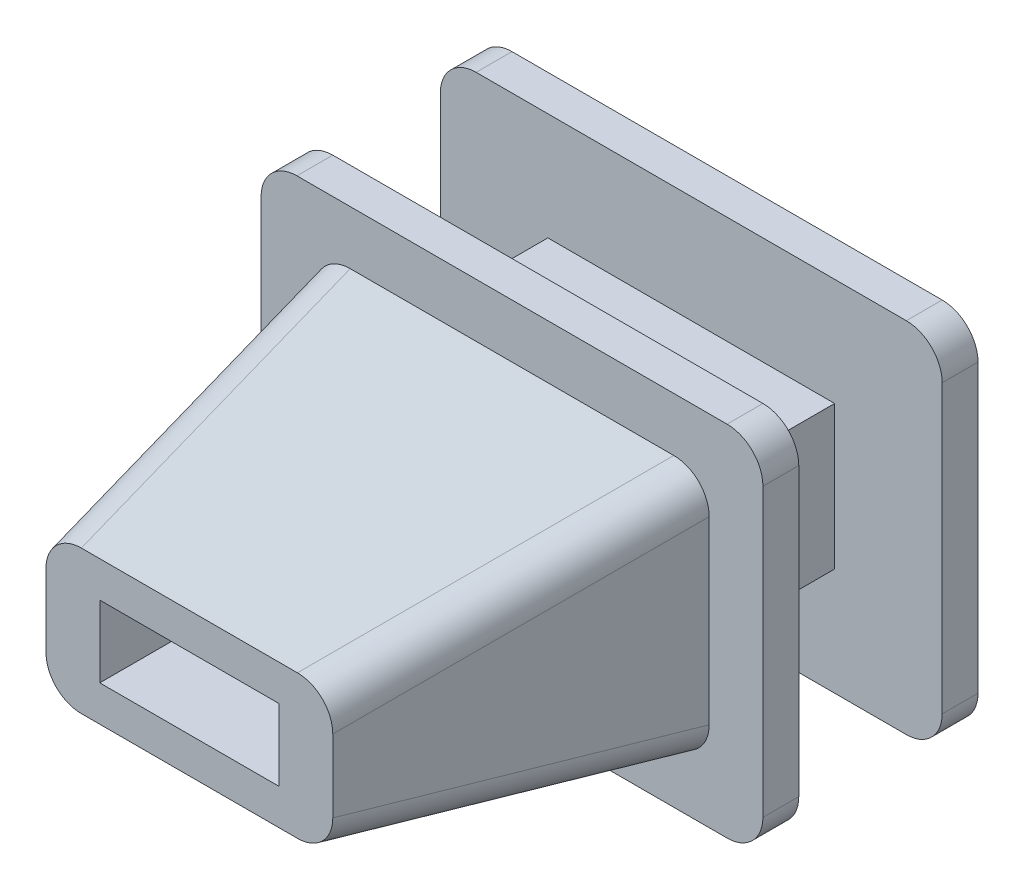
from build123d import *

# Parameters (mm, degrees)
ESQUISSE1_W             = 4
ESQUISSE1_H             = 2
BASE_EXTRUSION_DEPTH    = 2
BOSS_EXTRU_1_DEPTH      = 0.5
BOSS_EXTRU_2_START      = 0.5
BOSS_EXTRU_2_DEPTH      = 0.5
CONG_1_R                = 0.5
ESQUISSE6_W             = 2.5
ESQUISSE6_H             = 1
ENL_V_MAT_EXTRU_1_DEPTH = 9.645808302


with BuildPart() as part:
    # Esquisse1 → Base-Extrusion (new body)
    with BuildSketch(Plane.XY):
        Rectangle(ESQUISSE1_W, ESQUISSE1_H)
    extrude(amount=BASE_EXTRUSION_DEPTH)

    # Esquisse2 → Boss.-Extru.1 (add)
    with BuildSketch(Plane(origin=(0, 0, 0), x_dir=(-1, 0, 0), z_dir=(0, 0, -1))):
        with BuildLine():
            Line((-3, 2.5), (3, 2.5))
            ThreePointArc((3, 2.5), (3.353553391, 2.353553391), (3.5, 2))
            Line((3.5, 2), (3.5, -2))
            ThreePointArc((3.5, -2), (3.353553391, -2.353553391), (3, -2.5))
            Line((3, -2.5), (-3, -2.5))
            ThreePointArc((-3, -2.5), (-3.353553391, -2.353553391), (-3.5, -2))
            Line((-3.5, -2), (-3.5, 2))
            ThreePointArc((-3.5, 2), (-3.353553391, 2.353553391), (-3, 2.5))
        make_face()
    extrude(amount=BOSS_EXTRU_1_DEPTH)

    # Esquisse3 → Boss.-Extru.2 (add)
    with BuildSketch(Plane.XY.offset(2).offset(BOSS_EXTRU_2_START)):
        with BuildLine():
            Line((-3, -2.5), (3, -2.5))
            ThreePointArc((3, -2.5), (3.353553391, -2.353553391), (3.5, -2))
            Line((3.5, -2), (3.5, 2))
            ThreePointArc((3.5, 2), (3.353553391, 2.353553391), (3, 2.5))
            Line((3, 2.5), (-3, 2.5))
            ThreePointArc((-3, 2.5), (-3.353553391, 2.353553391), (-3.5, 2))
            Line((-3.5, 2), (-3.5, -2))
            ThreePointArc((-3.5, -2), (-3.353553391, -2.353553391), (-3, -2.5))
        make_face()
    extrude(amount=-BOSS_EXTRU_2_DEPTH)

    # Esquisse4 → Boss.-Lissage1 section 0
    with BuildSketch(Plane.XY.offset(2.5)):
        with BuildLine():
            Line((-2.75, 1.75), (2.75, 1.75))
            Line((2.75, 1.75), (2.75, -1.75))
            Line((2.75, -1.75), (-2.75, -1.75))
            Line((-2.75, -1.75), (-2.75, 1.75))
        make_face()
    # Esquisse5 → Boss.-Lissage1 section 1
    with BuildSketch(Plane.XY.offset(7)):
        with BuildLine():
            Line((2, 1), (-2, 1))
            Line((-2, 1), (-2, -1))
            Line((-2, -1), (2, -1))
            Line((2, -1), (2, 1))
        make_face()
    loft()

    # Congé1
    cong_1_edges = [part.edges().sort_by_distance(p)[0] for p in [
        (-2.375, 1.375, 4.75),
        (2.375, 1.375, 4.75),
        (-2.375, -1.375, 4.75),
        (2.375, -1.375, 4.75),
    ]]
    fillet(cong_1_edges, radius=CONG_1_R)

    # Esquisse6 → Enlèv. mat.-Extru.1 (cut, through all)
    with BuildSketch(Plane.XY.offset(7)):
        Rectangle(ESQUISSE6_W, ESQUISSE6_H)
    extrude(amount=-ENL_V_MAT_EXTRU_1_DEPTH, mode=Mode.SUBTRACT)


solid = part.part
